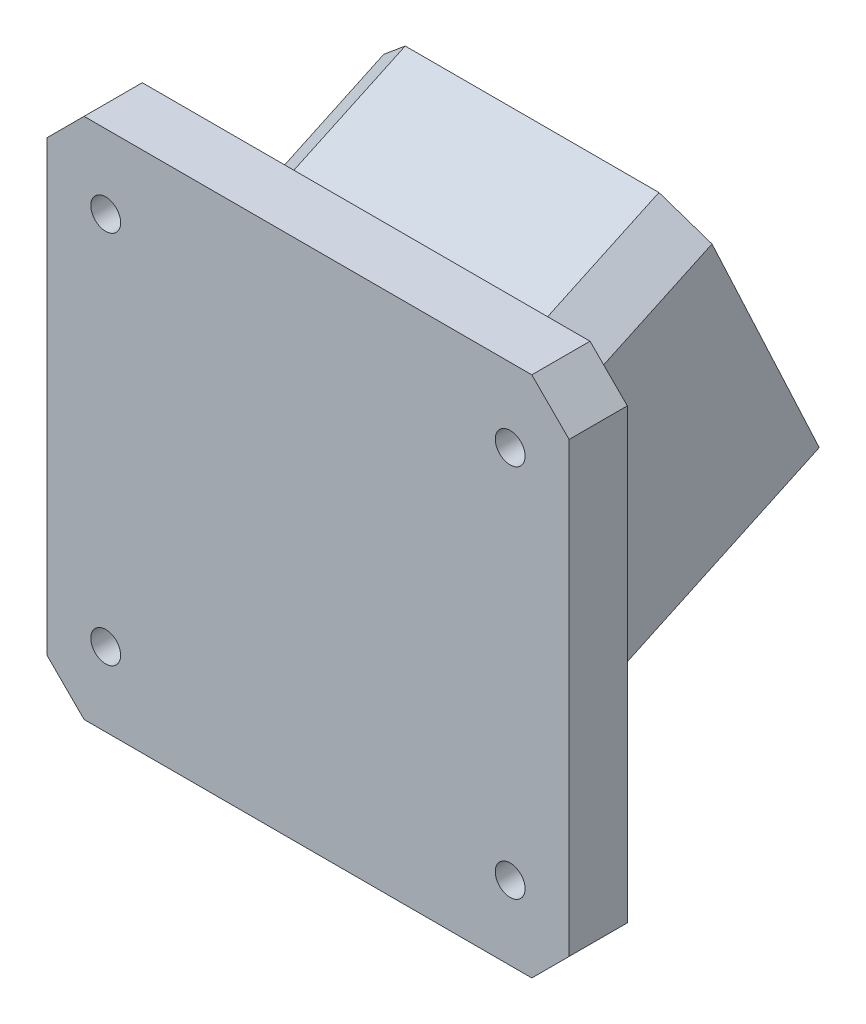
from build123d import *

# Parameters (mm, degrees)
BOSS_EXTRUDE1_DEPTH       = 3.9
SKETCH2_R                 = 1
CUT_EXTRUDE3_DEPTH        = 29.385031266
BOSS_EXTRUDE11_DEPTH      = 10
BOSS_EXTRUDE11_DEPTH_BACK = 15
SKETCH161_R               = 8
CUT_EXTRUDE5_DEPTH        = 10


with BuildPart() as part:
    # Sketch1 → Boss-Extrude1 (new body)
    with BuildSketch(Plane.XY):
        Polygon((17.5, 15), (15, 17.5), (-15, 17.5), (-17.5, 15), (-17.5, -15), (-15, -17.5), (15, -17.5), (17.5, -15), align=None)
    extrude(amount=BOSS_EXTRUDE1_DEPTH)

    # Sketch2 → Cut-Extrude3 (cut, through all)
    with BuildSketch(Plane.XY.offset(13.9)):
        with Locations((-13.55, 12.55)):
            Circle(SKETCH2_R)
        with Locations((-13.55, -12.55)):
            Circle(SKETCH2_R)
        with Locations((13.55, 12.55)):
            Circle(SKETCH2_R)
        with Locations((13.55, -12.55)):
            Circle(SKETCH2_R)
    extrude(amount=-CUT_EXTRUDE3_DEPTH, mode=Mode.SUBTRACT)

    # Sketch161 → Boss-Extrude11 (add, two sides: drawn at the far end of the back side and taken through both)
    with BuildSketch(Plane(origin=(0, 3.125608415, -6.702888877), x_dir=(-1, 0, 0), z_dir=(0, 0.42261826174068795, -0.9063077870366554)).offset(-BOSS_EXTRUDE11_DEPTH_BACK)):
        Polygon((-8.5, 11), (-11, 8.5), (-11, -8.5), (-8.5, -11), (8.5, -11), (11, -8.5), (11, 8.5), (8.5, 11), align=None)
        with Locations(Location((0, 0, 0), (0, 0, 270))):
            Circle(SKETCH161_R, mode=Mode.SUBTRACT)
    extrude(amount=BOSS_EXTRUDE11_DEPTH + BOSS_EXTRUDE11_DEPTH_BACK)

    # Sketch162 → Cut-Extrude5 (cut)
    with BuildSketch(Plane.XY.offset(13.9)):
        Polygon((-17.5, 15), (-15, 17.5), (15, 17.5), (17.5, 15), (17.5, -15), (15, -17.5), (-15, -17.5), (-17.5, -15), align=None)
    extrude(amount=-CUT_EXTRUDE5_DEPTH, mode=Mode.SUBTRACT)


solid = part.part
